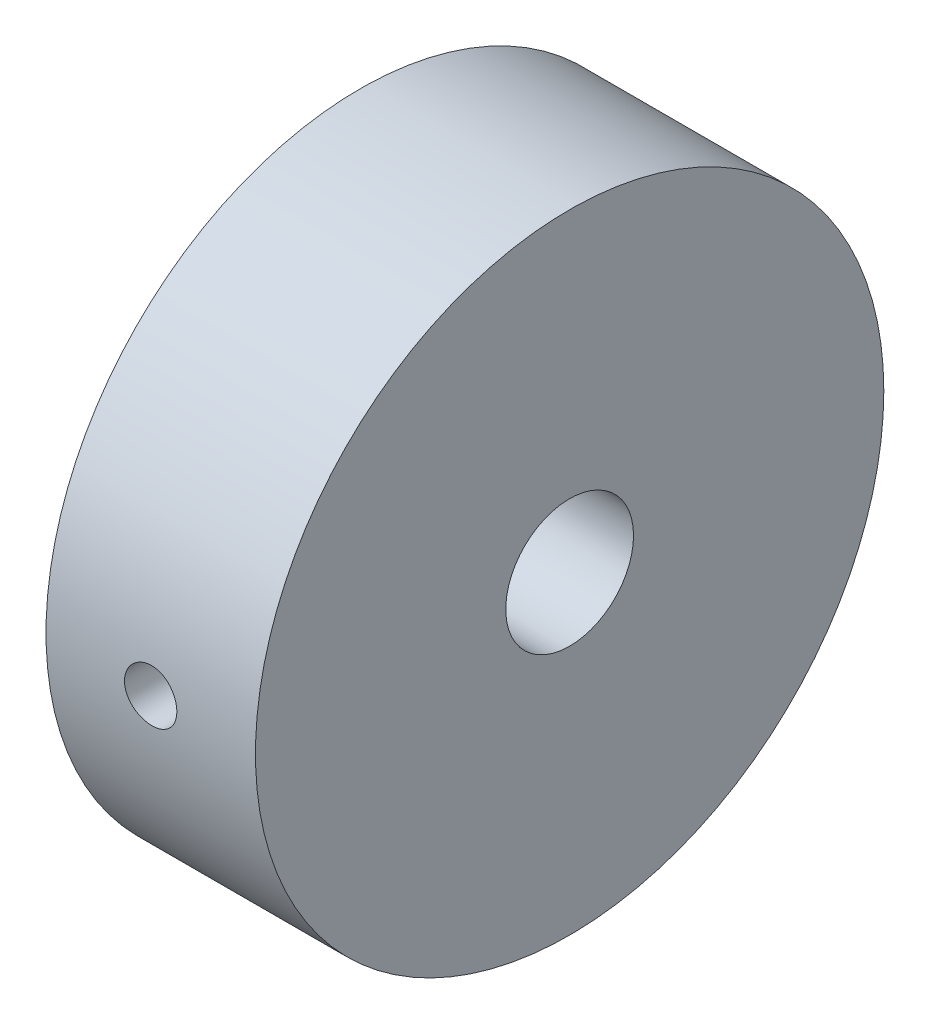
from build123d import *

# Parameters (mm, degrees)
ESQUISSE1_R            = 15
ESQUISSE1_R_2          = 3.05
BOSS_EXTRU_1_DEPTH     = 10
TROU_TARAUD_M31_REACH  = 35.966
TROU_TARAUD_M31_BORE_R = 1.25


with BuildPart() as part:
    # Esquisse1 → Boss.-Extru.1 (new body)
    with BuildSketch(Plane(origin=(0, 0, 0), x_dir=(0, 0, -1), z_dir=(1, 0, 0))):
        Circle(ESQUISSE1_R)
        Circle(ESQUISSE1_R_2, mode=Mode.SUBTRACT)
    extrude(amount=BOSS_EXTRU_1_DEPTH)

    # Trou taraudé M31 bore (on position points) → Trou taraudé M31 (cut, up to next)
    with BuildSketch(Plane(origin=(4.995608071, -0.123073033, 14.999495092), x_dir=(0, 0.999966339497, 0.00820486885), z_dir=(0, -0.00820486885, 0.999966339497)), mode=Mode.PRIVATE) as trou_taraud_m31_sk1:
        Circle(TROU_TARAUD_M31_BORE_R)
    trou_taraud_m31_tool1 = extrude(trou_taraud_m31_sk1.sketch, amount=-TROU_TARAUD_M31_REACH, mode=Mode.PRIVATE) & part.part
    add(trou_taraud_m31_tool1.solids().sort_by_distance((4.995608, -0.123073, 14.999495))[0], mode=Mode.SUBTRACT)


solid = part.part
